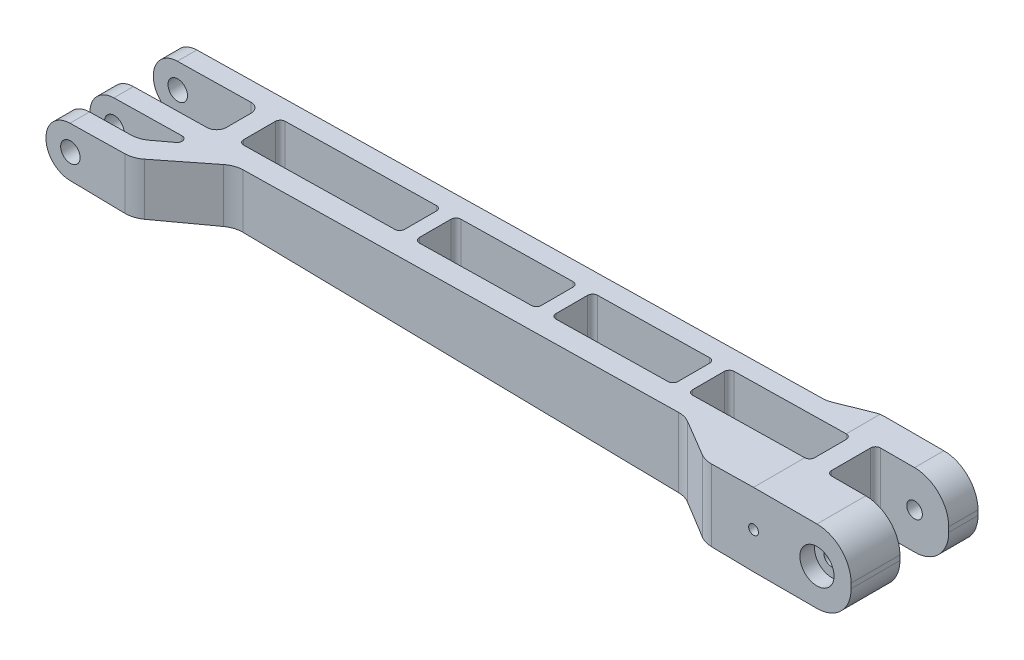
from build123d import *

# Parameters (mm, degrees)
BOSS_EXTRUDE1_DEPTH = 15
CUT_EXTRUDE1_DEPTH  = 136.508273532
SKETCH3_R           = 2
CUT_EXTRUDE2_DEPTH  = 136.508273532
SKETCH4_R           = 1.6
CUT_EXTRUDE3_DEPTH  = 135.898080771
FILLET1_R           = 5
FILLET2_R           = 7
SKETCH6_R           = 3.5
CUT_EXTRUDE4_DEPTH  = 3
SKETCH7_R           = 1
CUT_EXTRUDE5_DEPTH  = 5


with BuildPart() as part:
    # Sketch1 → Boss-Extrude1 (new body)
    with BuildSketch(Plane(origin=(0, 0, 0), x_dir=(1, 0, 0), z_dir=(0, 1, 0))):
        with BuildLine():
            Line((-30.483870968, -13.842203604), (-30.483870968, -17.842203604))
            Line((-30.483870968, -17.842203604), (-15.483870968, -17.842203604))
            Line((-15.483870968, -17.842203604), (-11.604336021, -17.842203604))
            ThreePointArc((-11.604336021, -17.842203604), (-10.652040513, -18.537026173), (-11.023097827, -19.655937075))
            Line((-11.023097827, -19.655937075), (-14.180005266, -21.91087096))
            ThreePointArc((-14.180005266, -21.91087096), (-15.56030908, -22.603681147), (-17.086196235, -22.842203604))
            Line((-17.086196235, -22.842203604), (-30.483870968, -22.842203604))
            Line((-30.483870968, -22.842203604), (-30.483870968, -26.842203604))
            Line((-30.483870968, -26.842203604), (-14.306659767, -26.842203604))
            ThreePointArc((-14.306659767, -26.842203604), (-12.714208629, -26.581834325), (-11.287607633, -25.827843353))
            Line((-11.287607633, -25.827843353), (-2.084385084, -18.856563855))
            ThreePointArc((-2.084385084, -18.856563855), (-0.657784088, -18.102572883), (0.93466705, -17.842203604))
            Line((0.93466705, -17.842203604), (90.131209208, -17.842203604))
            ThreePointArc((90.131209208, -17.842203604), (91.465877117, -18.023628963), (92.703687985, -18.554738975))
            Line((92.703687985, -18.554738975), (100.32857008, -23.129668233))
            ThreePointArc((100.32857008, -23.129668233), (101.566380948, -23.660778245), (102.901048857, -23.842203604))
            Line((102.901048857, -23.842203604), (131.516129032, -23.842203604))
            Line((131.516129032, -23.842203604), (131.516129032, -13.842203604))
            Line((131.516129032, -13.842203604), (117.516129032, -13.842203604))
            ThreePointArc((117.516129032, -13.842203604), (116.809022251, -13.549310385), (116.516129032, -12.842203604))
            Line((116.516129032, -12.842203604), (116.516129032, -4.842203604))
            ThreePointArc((116.516129032, -4.842203604), (116.809022251, -4.135096823), (117.516129032, -3.842203604))
            Line((117.516129032, -3.842203604), (131.516129032, -3.842203604))
            Line((131.516129032, -3.842203604), (131.516129032, -0.842203604))
            Line((131.516129032, -0.842203604), (131.516129032, 2.157796396))
            Line((131.516129032, 2.157796396), (112.422801941, 2.157796396))
            ThreePointArc((112.422801941, 2.157796396), (111.530677914, 2.077564147), (110.667184733, 1.839442284))
            Line((110.667184733, 1.839442284), (104.365073331, -0.523849492))
            ThreePointArc((104.365073331, -0.523849492), (103.501580151, -0.761971355), (102.609456123, -0.842203604))
            Line((102.609456123, -0.842203604), (-30.483870968, -0.842203604))
            Line((-30.483870968, -0.842203604), (-30.483870968, -4.842203604))
            Line((-30.483870968, -4.842203604), (-10.483870968, -4.842203604))
            ThreePointArc((-10.483870968, -4.842203604), (-9.069657405, -5.427990042), (-8.483870968, -6.842203604))
            Line((-8.483870968, -6.842203604), (-8.483870968, -11.842203604))
            ThreePointArc((-8.483870968, -11.842203604), (-9.069657405, -13.256417166), (-10.483870968, -13.842203604))
            Line((-10.483870968, -13.842203604), (-30.483870968, -13.842203604))
        make_face()
        with BuildLine():
            Line((-3.483870968, -4.842203604), (27.516129032, -4.842203604))
            ThreePointArc((27.516129032, -4.842203604), (28.223235813, -5.135096823), (28.516129032, -5.842203604))
            Line((28.516129032, -5.842203604), (28.516129032, -12.336203873))
            ThreePointArc((28.516129032, -12.336203873), (28.223235813, -13.043310655), (27.516129032, -13.336203873))
            Line((27.516129032, -13.336203873), (-3.483870968, -13.336203873))
            ThreePointArc((-3.483870968, -13.336203873), (-4.190977749, -13.043310655), (-4.483870968, -12.336203873))
            Line((-4.483870968, -12.336203873), (-4.483870968, -5.842203604))
            ThreePointArc((-4.483870968, -5.842203604), (-4.190977749, -5.135096823), (-3.483870968, -4.842203604))
        make_face(mode=Mode.SUBTRACT)
        with BuildLine():
            Line((32.516129032, -4.842203604), (55.516129032, -4.842203604))
            ThreePointArc((55.516129032, -4.842203604), (56.223235813, -5.135096823), (56.516129032, -5.842203604))
            Line((56.516129032, -5.842203604), (56.516129032, -12.336203873))
            ThreePointArc((56.516129032, -12.336203873), (56.223235813, -13.043310655), (55.516129032, -13.336203873))
            Line((55.516129032, -13.336203873), (32.516129032, -13.336203873))
            ThreePointArc((32.516129032, -13.336203873), (31.809022251, -13.043310655), (31.516129032, -12.336203873))
            Line((31.516129032, -12.336203873), (31.516129032, -5.842203604))
            ThreePointArc((31.516129032, -5.842203604), (31.809022251, -5.135096823), (32.516129032, -4.842203604))
        make_face(mode=Mode.SUBTRACT)
        with BuildLine():
            Line((60.516129032, -4.842203604), (83.516129032, -4.842203604))
            ThreePointArc((83.516129032, -4.842203604), (84.223235813, -5.135096823), (84.516129032, -5.842203604))
            Line((84.516129032, -5.842203604), (84.516129032, -12.336203873))
            ThreePointArc((84.516129032, -12.336203873), (84.223235813, -13.043310655), (83.516129032, -13.336203873))
            Line((83.516129032, -13.336203873), (60.516129032, -13.336203873))
            ThreePointArc((60.516129032, -13.336203873), (59.809022251, -13.043310655), (59.516129032, -12.336203873))
            Line((59.516129032, -12.336203873), (59.516129032, -5.842203604))
            ThreePointArc((59.516129032, -5.842203604), (59.809022251, -5.135096823), (60.516129032, -4.842203604))
        make_face(mode=Mode.SUBTRACT)
        with BuildLine():
            Line((88.516129032, -4.842203604), (111.516129032, -4.842203604))
            ThreePointArc((111.516129032, -4.842203604), (112.223235813, -5.135096823), (112.516129032, -5.842203604))
            Line((112.516129032, -5.842203604), (112.516129032, -12.336203873))
            ThreePointArc((112.516129032, -12.336203873), (112.223235813, -13.043310655), (111.516129032, -13.336203873))
            Line((111.516129032, -13.336203873), (88.516129032, -13.336203873))
            ThreePointArc((88.516129032, -13.336203873), (87.809022251, -13.043310655), (87.516129032, -12.336203873))
            Line((87.516129032, -12.336203873), (87.516129032, -5.842203604))
            ThreePointArc((87.516129032, -5.842203604), (87.809022251, -5.135096823), (88.516129032, -4.842203604))
        make_face(mode=Mode.SUBTRACT)
    extrude(amount=BOSS_EXTRUDE1_DEPTH)

    # Sketch2 → Cut-Extrude1 (cut, through all)
    with BuildSketch(Plane.XY.offset(26.842203604)):
        Polygon((-14.306659767, 2.215189944), (-30.483870968, 2.5), (-30.483870968, 0), (-14.306659767, 0), align=None)
        Polygon((111.516129032, 0), (-14.306659767, 2.215189944), (-14.306659767, 0), align=None)
        Polygon((-30.483870968, 15), (-30.483870968, 12.5), (-14.306659767, 12.784810056), (-14.306659767, 15), align=None)
        Polygon((-14.306659767, 15), (-14.306659767, 12.784810056), (111.516129032, 15), align=None)
    extrude(amount=-CUT_EXTRUDE1_DEPTH, mode=Mode.SUBTRACT)

    # Sketch3 → Cut-Extrude2 (cut, through all)
    with BuildSketch(Plane.XY.offset(26.842203604)):
        with Locations((-25.483870968, 7.5)):
            Circle(SKETCH3_R)
    extrude(amount=-CUT_EXTRUDE2_DEPTH, mode=Mode.SUBTRACT)

    # Sketch4 → Cut-Extrude3 (cut, through all)
    with BuildSketch(Plane.XY.offset(23.842203604)):
        with Locations((124.516129032, 7.5)):
            Circle(SKETCH4_R)
    extrude(amount=-CUT_EXTRUDE3_DEPTH, mode=Mode.SUBTRACT)

    # Fillet1
    fillet1_edges = [part.edges().sort_by_distance(p)[0] for p in [
        (-30.483870968, 2.5, 2.842203604),
        (-30.483870968, 2.5, 15.842203604),
        (-30.483870968, 2.5, 24.842203604),
        (-30.483870968, 12.5, 2.842203604),
        (-30.483870968, 12.5, 15.842203604),
        (-30.483870968, 12.5, 24.842203604),
    ]]
    fillet(fillet1_edges, radius=FILLET1_R)

    # Fillet2
    fillet2_edges = [part.edges().sort_by_distance(p)[0] for p in [
        (131.516129032, 0, 0.842203604),
        (131.516129032, 0, 18.842203604),
        (131.516129032, 15, 18.842203604),
        (131.516129032, 15, 0.842203604),
    ]]
    fillet(fillet2_edges, radius=FILLET2_R)

    # Sketch6 → Cut-Extrude4 (cut)
    with BuildSketch(Plane.XY.offset(23.842203604)):
        with Locations((124.516129032, 7.5)):
            Circle(SKETCH6_R)
    extrude(amount=-CUT_EXTRUDE4_DEPTH, mode=Mode.SUBTRACT)

    # Sketch7 → Cut-Extrude5 (cut)
    with BuildSketch(Plane.XY.offset(23.842203604)):
        with Locations((111.516129032, 7.5)):
            Circle(SKETCH7_R)
    extrude(amount=-CUT_EXTRUDE5_DEPTH, mode=Mode.SUBTRACT)


solid = part.part
